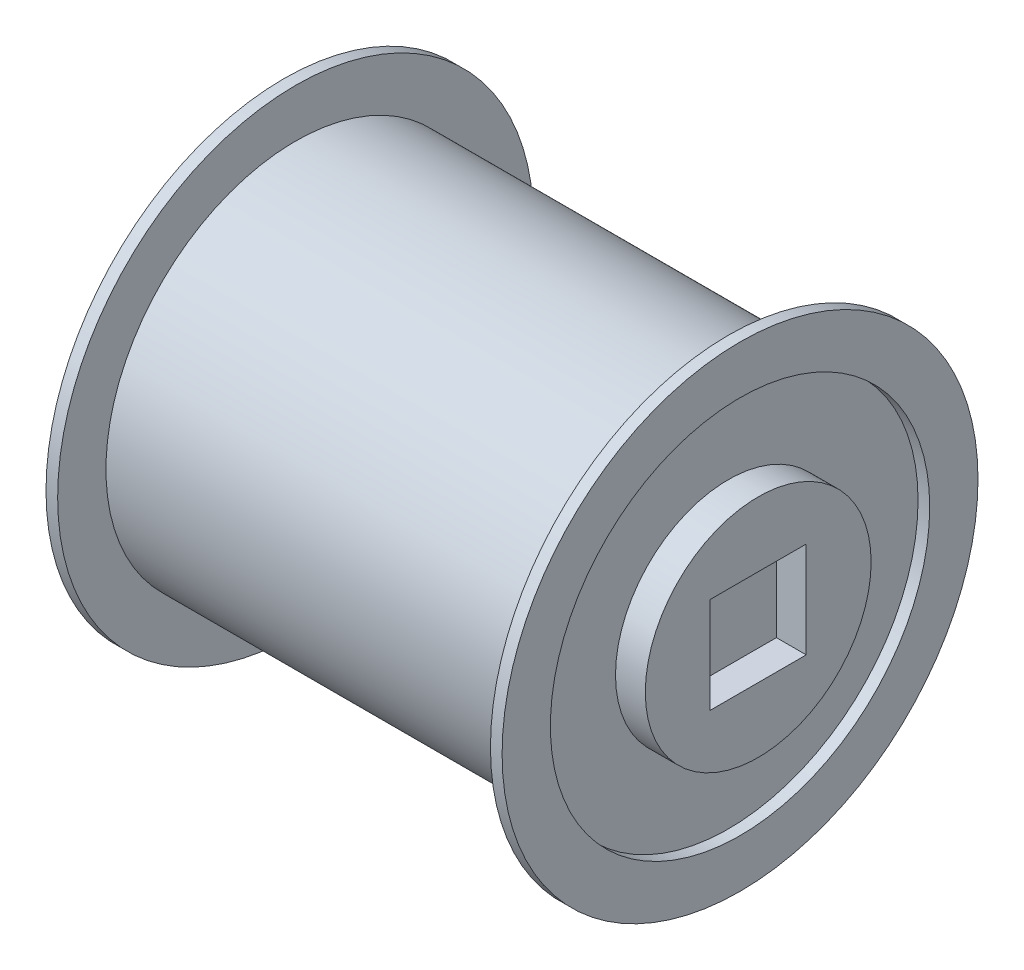
from build123d import *

# Parameters (mm, degrees)
BOSS_EXTRUDE3_DEPTH      = 39.71
BOSS_EXTRUDE3_DEPTH_BACK = 2.56
SKETCH12_R               = 9.692202823
SKETCH12_W               = 8.24061712
SKETCH12_H               = 8.24061712
SKETCH12_9_R             = 20.425
SKETCH12_9_R_2           = 16.28
BOSS_EXTRUDE4_DEPTH      = 1
SKETCH12_11_R            = 16.28
SKETCH12_11_R_2          = 9.692202823
SKETCH12_11_W            = 8.24061712
SKETCH12_11_H            = 8.24061712
BOSS_EXTRUDE6_DEPTH      = 37.15
LPATTERN1_COUNT          = 2
LPATTERN1_PITCH          = 38.15


with BuildPart() as part:
    # Sketch12 → Boss-Extrude3 (new, two sides: drawn at the far end of the back side and taken through both)
    with BuildSketch(Plane(origin=(0, 0, 0), x_dir=(0, 0, -1), z_dir=(1, 0, 0)).offset(-BOSS_EXTRUDE3_DEPTH_BACK)):
        Circle(SKETCH12_R)
        Rectangle(SKETCH12_W, SKETCH12_H, mode=Mode.SUBTRACT)
    extrude(amount=BOSS_EXTRUDE3_DEPTH + BOSS_EXTRUDE3_DEPTH_BACK)

    # Sketch12<11> → Boss-Extrude6 (add)
    # profile 1 of 2: a face of its own
    with BuildSketch(Plane(origin=(0, 0, 0), x_dir=(0, 0, -1), z_dir=(1, 0, 0))):
        Circle(SKETCH12_11_R)
        Circle(SKETCH12_11_R_2, mode=Mode.SUBTRACT)
    # profile 2 of 2: a face of its own
    with BuildSketch(Plane(origin=(0, 0, 0), x_dir=(0, 0, -1), z_dir=(1, 0, 0))):
        Rectangle(SKETCH12_11_W, SKETCH12_11_H)
    extrude(amount=BOSS_EXTRUDE6_DEPTH)


with BuildPart() as body_2:
    # Sketch12<9> → Boss-Extrude4 (new body)
    with BuildSketch(Plane(origin=(0, 0, 0), x_dir=(0, 0, -1), z_dir=(1, 0, 0))):
        Circle(SKETCH12_9_R)
        Circle(SKETCH12_9_R_2, mode=Mode.SUBTRACT)
    boss_extrude4 = extrude(amount=-BOSS_EXTRUDE4_DEPTH)


with BuildPart() as lpattern1_1:
    # LPattern1: Boss-Extrude4 ×2
    with Locations(*[(i * LPATTERN1_PITCH, 0, 0) for i in range(1, LPATTERN1_COUNT)]):
        add(boss_extrude4)


solid = Compound([part.part, body_2.part, lpattern1_1.part])
